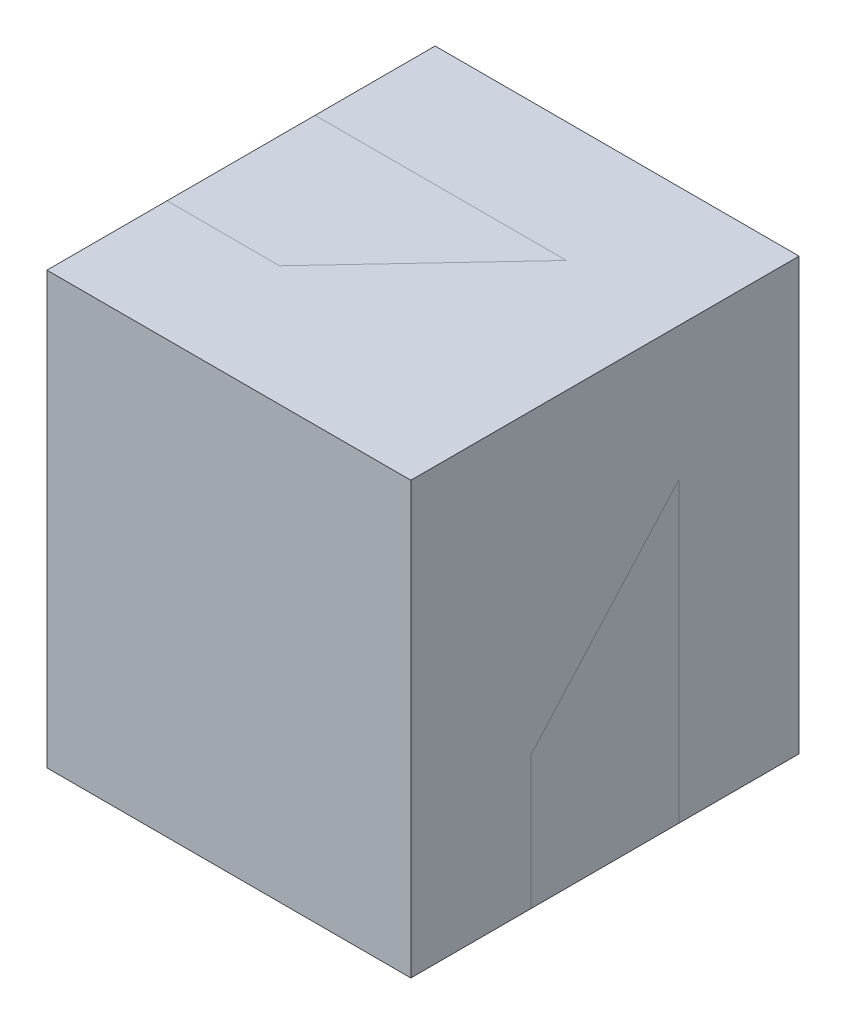
from build123d import *

# Parameters (mm, degrees)
SKETCH1_W             = 81.79
SKETCH1_H             = 96.88
BOSS_EXTRUDE1_DEPTH   = 16.635
BOSS_EXTRUDE2_DEPTH   = 26.99
FILLET1_R             = 5
FILLET1_OF_MIRROR1_R  = 5
SKETCH3_W             = 14.735
SKETCH3_H             = 20.525
BOSS_EXTRUDE3_DEPTH   = 1
BOSS_EXTRUDE3_2_DEPTH = 1
BOSS_EXTRUDE3_3_DEPTH = 1
BOSS_EXTRUDE3_4_DEPTH = 1
FILLET2_R             = 5
FILLET3_R             = 5
FILLET4_R             = 5
FILLET5_R             = 5
SKETCH4_W             = 81.79
SKETCH4_H             = 87.25
BOSS_EXTRUDE4_DEPTH   = 96.88
SKETCH6_R             = 6.35
BOSS_EXTRUDE5_DEPTH   = 2


with BuildPart() as part:
    # Sketch1 → Boss-Extrude1 (new, symmetric)
    with BuildSketch(Plane.XY):
        with Locations((40.895, 48.44)):
            Rectangle(SKETCH1_W, SKETCH1_H)
    extrude(amount=BOSS_EXTRUDE1_DEPTH, both=True)

    # Sketch2 → Boss-Extrude2 (add)
    with BuildSketch(Plane.XY.offset(16.635)):
        with BuildLine():
            Line((19.735, 0), (62.055, 0))
            ThreePointArc((62.055, 0), (65.590533906, 1.464466094), (67.055, 5))
            Line((67.055, 5), (67.055, 79.63))
            ThreePointArc((67.055, 79.63), (65.590533906, 83.165533906), (62.055, 84.63))
            Line((62.055, 84.63), (19.735, 84.63))
            ThreePointArc((19.735, 84.63), (16.199466094, 83.165533906), (14.735, 79.63))
            Line((14.735, 79.63), (14.735, 5))
            ThreePointArc((14.735, 5), (16.199466094, 1.464466094), (19.735, 0))
        make_face()
    boss_extrude2 = extrude(amount=BOSS_EXTRUDE2_DEPTH)

    # Fillet1
    fillet1_edges = [part.edges().sort_by_distance(p)[0] for p in [
        (65.590533906, 1.464466094, 43.625),
        (67.055, 42.315, 43.625),
        (65.590533906, 83.165533906, 43.625),
        (40.895, 84.63, 43.625),
        (16.199466094, 83.165533906, 43.625),
        (14.735, 42.315, 43.625),
        (16.199466094, 1.464466094, 43.625),
        (40.895, 0, 43.625),
    ]]
    fillet(fillet1_edges, radius=FILLET1_R)

    # Mirror1: Boss-Extrude2 across plane
    add(boss_extrude2.mirror(Plane.XY))

    # Fillet1 of Mirror1
    fillet1_of_mirror1_edges = [part.edges().sort_by_distance(p)[0] for p in [
        (65.590533906, 1.464466094, -43.625),
        (67.055, 42.315, -43.625),
        (65.590533906, 83.165533906, -43.625),
        (40.895, 84.63, -43.625),
        (16.199466094, 83.165533906, -43.625),
        (14.735, 42.315, -43.625),
        (16.199466094, 1.464466094, -43.625),
        (40.895, 0, -43.625),
    ]]
    fillet(fillet1_of_mirror1_edges, radius=FILLET1_OF_MIRROR1_R)

    # Sketch6 → Boss-Extrude5 (add)
    with BuildSketch(Plane.XZ):
        with Locations(Location((40.895, 28.525, 0), (0, 0, 90))):
            Circle(SKETCH6_R)
        with Locations(Location((40.895, -28.525, 0), (0, 0, 90))):
            Circle(SKETCH6_R)
    extrude(amount=BOSS_EXTRUDE5_DEPTH)


with BuildPart() as body_2:
    # Sketch3 → Boss-Extrude3 (new body)
    with BuildSketch(Plane.XZ):
        with Locations((7.3675, 26.8975)):
            Rectangle(SKETCH3_W, SKETCH3_H)
        with BuildLine():
            Line((6.565, 30.535), (6.565, 25.375))
            ThreePointArc((6.565, 25.375), (9.145, 22.795), (11.725, 25.375))
            Line((11.725, 25.375), (11.725, 30.535))
            ThreePointArc((11.725, 30.535), (9.145, 33.115), (6.565, 30.535))
        make_face(mode=Mode.SUBTRACT)
    extrude(amount=-BOSS_EXTRUDE3_DEPTH)

    # Fillet4
    fillet4_edges = [body_2.edges().sort_by_distance(p)[0] for p in [
        (0, 0.5, 37.16),
    ]]
    fillet(fillet4_edges, radius=FILLET4_R)


with BuildPart() as body_3:
    # Sketch3 → Boss-Extrude3 2 (new body)
    with BuildSketch(Plane.XZ):
        with Locations((7.3675, -26.8975)):
            Rectangle(SKETCH3_W, SKETCH3_H)
        with BuildLine():
            Line((6.565, -30.535), (6.565, -25.375))
            ThreePointArc((6.565, -25.375), (9.145, -22.795), (11.725, -25.375))
            Line((11.725, -25.375), (11.725, -30.535))
            ThreePointArc((11.725, -30.535), (9.145, -33.115), (6.565, -30.535))
        make_face(mode=Mode.SUBTRACT)
    extrude(amount=-BOSS_EXTRUDE3_2_DEPTH)

    # Fillet5
    fillet5_edges = [body_3.edges().sort_by_distance(p)[0] for p in [
        (0, 0.5, -37.16),
    ]]
    fillet(fillet5_edges, radius=FILLET5_R)


with BuildPart() as body_4:
    # Sketch3 → Boss-Extrude3 3 (new body)
    with BuildSketch(Plane.XZ):
        with Locations((74.4225, -26.8975)):
            Rectangle(SKETCH3_W, SKETCH3_H)
        with BuildLine():
            Line((70.065, -25.375), (70.065, -30.535))
            ThreePointArc((70.065, -30.535), (72.645, -33.115), (75.225, -30.535))
            Line((75.225, -30.535), (75.225, -25.375))
            ThreePointArc((75.225, -25.375), (72.645, -22.795), (70.065, -25.375))
        make_face(mode=Mode.SUBTRACT)
    extrude(amount=-BOSS_EXTRUDE3_3_DEPTH)

    # Fillet3
    fillet3_edges = [body_4.edges().sort_by_distance(p)[0] for p in [
        (81.79, 0.5, -37.16),
    ]]
    fillet(fillet3_edges, radius=FILLET3_R)


with BuildPart() as body_5:
    # Sketch3 → Boss-Extrude3 4 (new body)
    with BuildSketch(Plane.XZ):
        with Locations((74.4225, 26.8975)):
            Rectangle(SKETCH3_W, SKETCH3_H)
        with BuildLine():
            Line((70.065, 25.375), (70.065, 30.535))
            ThreePointArc((70.065, 30.535), (72.645, 33.115), (75.225, 30.535))
            Line((75.225, 30.535), (75.225, 25.375))
            ThreePointArc((75.225, 25.375), (72.645, 22.795), (70.065, 25.375))
        make_face(mode=Mode.SUBTRACT)
    extrude(amount=-BOSS_EXTRUDE3_4_DEPTH)

    # Fillet2
    fillet2_edges = [body_5.edges().sort_by_distance(p)[0] for p in [
        (81.79, 0.5, 37.16),
    ]]
    fillet(fillet2_edges, radius=FILLET2_R)


with BuildPart() as body_6:
    # Sketch4 → Boss-Extrude4 (new body)
    with BuildSketch(Plane.XZ):
        with Locations((40.895, 0)):
            Rectangle(SKETCH4_W, SKETCH4_H)
    extrude(amount=-BOSS_EXTRUDE4_DEPTH)


solid = Compound([part.part, body_2.part, body_3.part, body_4.part, body_5.part, body_6.part])
